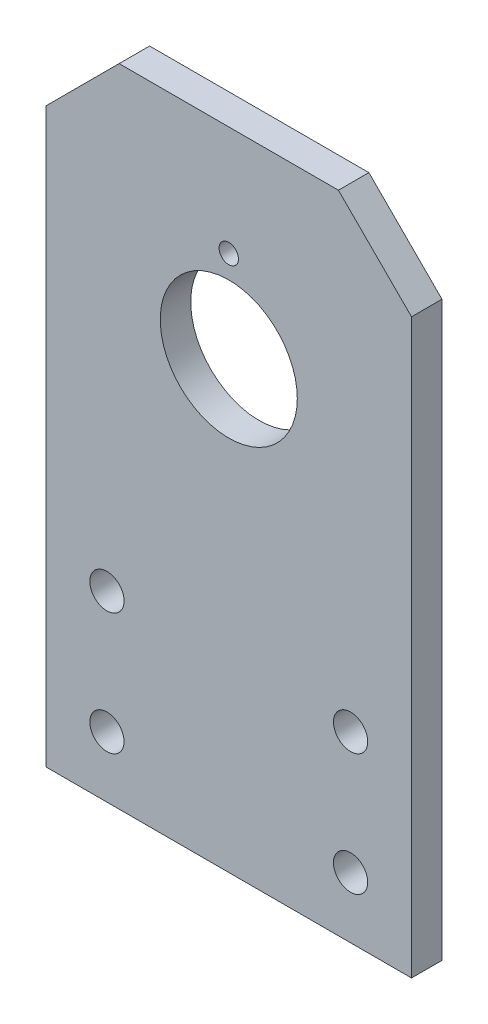
from build123d import *

# Parameters (mm, degrees)
SKETCH1_W              = 76.2
SKETCH1_H              = 134.62
BOSS_EXTRUDE1_DEPTH    = 6.35
SKETCH2_R              = 14.2875
CUT_EXTRUDE1_DEPTH     = 155.820240602
SKETCH3_R              = 3.571875
CUT_EXTRUDE2_DEPTH     = 155.820240602
CHAMFER1_SIZE          = 15.24
F_10_32_TAPPED_HOLE1_D = 4.0386


with BuildPart() as part:
    # Sketch1 → Boss-Extrude1 (new body)
    with BuildSketch(Plane.XY):
        with Locations((38.1, -67.31)):
            Rectangle(SKETCH1_W, SKETCH1_H)
    extrude(amount=BOSS_EXTRUDE1_DEPTH)

    # Sketch2 → Cut-Extrude1 (cut, through all)
    with BuildSketch(Plane.XY.offset(6.35)):
        with Locations((38.1, -41.91)):
            Circle(SKETCH2_R)
    extrude(amount=-CUT_EXTRUDE1_DEPTH, mode=Mode.SUBTRACT)

    # Sketch3 → Cut-Extrude2 (cut, through all)
    with BuildSketch(Plane.XY.offset(6.35)):
        with Locations((12.7, -121.92)):
            Circle(SKETCH3_R)
        with Locations((63.5, -121.92)):
            Circle(SKETCH3_R)
        with Locations((12.7, -96.52)):
            Circle(SKETCH3_R)
        with Locations((63.5, -96.52)):
            Circle(SKETCH3_R)
    extrude(amount=-CUT_EXTRUDE2_DEPTH, mode=Mode.SUBTRACT)

    # Chamfer1
    chamfer1_edges = [part.edges().sort_by_distance(p)[0] for p in [
        (0, 0, 3.175),
        (76.2, 0, 3.175),
    ]]
    chamfer(chamfer1_edges, length=CHAMFER1_SIZE)

    # #10-32 Tapped Hole1 (through all)
    with Locations(Plane.XY.offset(6.35)):
        with Locations((38.1, -22.86)):
            Hole(F_10_32_TAPPED_HOLE1_D / 2)


solid = part.part
